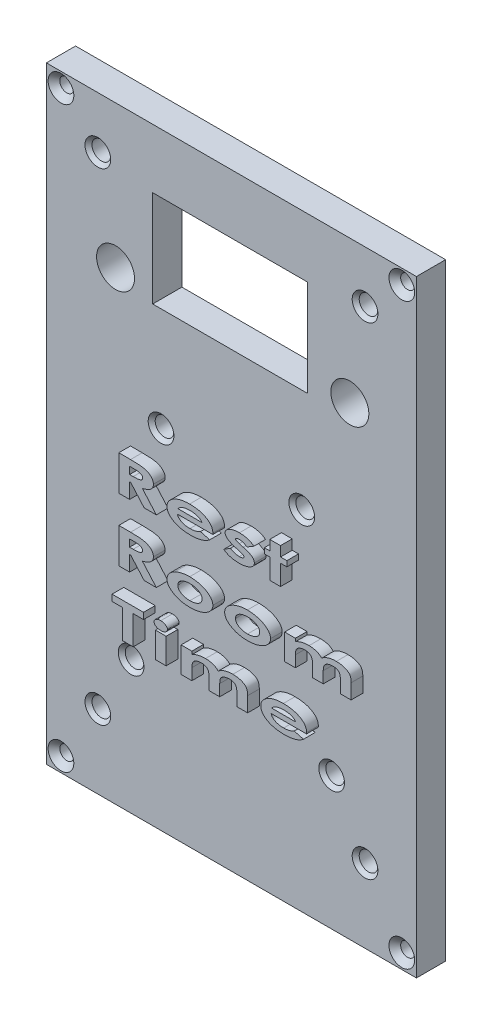
from build123d import *

# Parameters (mm, degrees)
SCHIZZO1_W                             = 63.340006879
SCHIZZO1_H                             = 103.980003745
SCHIZZO1_R                             = 1.6
SCHIZZO1_R_2                           = 3.25
SCHIZZO1_W_2                           = 26.5
SCHIZZO1_H_2                           = 16.5
ESTRUSIONE_ESTRUSIONE1_DEPTH           = 5
FORO_SVASATO_PER_VITE_M2_1_D           = 2.4
FORO_SVASATO_PER_VITE_M2_1_CSINK_D     = 4.4
FORO_SVASATO_PER_VITE_M2_1_CSINK_ANGLE = 90
FORO_SVASATO_PER_VITE_M2_2_D           = 2.4
FORO_SVASATO_PER_VITE_M2_2_CSINK_D     = 4.4
FORO_SVASATO_PER_VITE_M2_2_CSINK_ANGLE = 90
SCHIZZO10_W                            = 1.846153846
SCHIZZO10_H                            = 4.384615385
ESTRUSIONE_ESTRUSIONE3_DEPTH           = 2


with BuildPart() as part:
    # Schizzo1 → Estrusione-Estrusione1 (new body)
    with BuildSketch(Plane.XY):
        with Locations((45.670002815, -4.009999784)):
            Rectangle(SCHIZZO1_W, SCHIZZO1_H)
        with Locations((68.547653378, 39.133270494)):
            Circle(SCHIZZO1_R, mode=Mode.SUBTRACT)
        with Locations((22.813532798, 39.133270494)):
            Circle(SCHIZZO1_R, mode=Mode.SUBTRACT)
        with Locations((68.547653378, -43.377075301)):
            Circle(SCHIZZO1_R, mode=Mode.SUBTRACT)
        with Locations((22.813532798, -43.377075301)):
            Circle(SCHIZZO1_R, mode=Mode.SUBTRACT)
        with Locations((57.711115818, 3.59770492)):
            Circle(SCHIZZO1_R, mode=Mode.SUBTRACT)
        with Locations((33.630602395, 3.59770492)):
            Circle(SCHIZZO1_R, mode=Mode.SUBTRACT)
        with Locations((62.830042897, -33.235000951)):
            Circle(SCHIZZO1_R, mode=Mode.SUBTRACT)
        with Locations((28.504233864, -33.235000951)):
            Circle(SCHIZZO1_R, mode=Mode.SUBTRACT)
        with Locations((65.944072664, 23.559058576)):
            Circle(SCHIZZO1_R_2, mode=Mode.SUBTRACT)
        with Locations((25.84132705, 23.559058576)):
            Circle(SCHIZZO1_R_2, mode=Mode.SUBTRACT)
        with Locations((45.449738172, 29.587574645)):
            Rectangle(SCHIZZO1_W_2, SCHIZZO1_H_2, mode=Mode.SUBTRACT)
    extrude(amount=ESTRUSIONE_ESTRUSIONE1_DEPTH)

    # Foro svasato per Vite M2-1 (through all)
    with Locations(Plane.XY.offset(5)):
        with Locations((16.499999375, 45.480002088), (74.840006254, 45.480002088), (74.840006254, -53.500001657), (16.499999375, -53.500001657)):
            CounterSinkHole(FORO_SVASATO_PER_VITE_M2_1_D / 2, FORO_SVASATO_PER_VITE_M2_1_CSINK_D / 2, counter_sink_angle=FORO_SVASATO_PER_VITE_M2_1_CSINK_ANGLE)

    # Foro svasato per Vite M2-2 (through all)
    with Locations(Plane.XY.offset(5)):
        with Locations((33.630602395, 3.59770492), (57.711115818, 3.59770492), (62.830042897, -33.235000951), (28.504233864, -33.235000951), (22.813532798, -43.377075301), (68.547653378, -43.377075301), (68.547653378, 39.133270494), (22.813532798, 39.133270494)):
            CounterSinkHole(FORO_SVASATO_PER_VITE_M2_2_D / 2, FORO_SVASATO_PER_VITE_M2_2_CSINK_D / 2, counter_sink_angle=FORO_SVASATO_PER_VITE_M2_2_CSINK_ANGLE)

    # Schizzo10 → Estrusione-Estrusione3 (add)
    # profile 1 of 13: a face of its own
    with BuildSketch(Plane.XY.offset(5)):
        with BuildLine():
            Line((28.397988008, -1.610718218), (30.411209162, -1.610718218))
            add(Edge.make_bspline(
                [(30.411209162, -1.610718218), (30.543827285, -1.611018816), (30.799477441, -1.611598284), (31.168101714, -1.620484518), (31.507147991, -1.632952184), (31.816565795, -1.651895509), (32.096313443, -1.67693031), (32.346477034, -1.706641794), (32.566908104, -1.740391776), (32.760626099, -1.781872922), (32.935309055, -1.830084867), (33.098446352, -1.88355872), (33.252934455, -1.945102952), (33.398677263, -2.013656524), (33.535949325, -2.088993376), (33.663988148, -2.172846524), (33.784329673, -2.262356707), (33.894847104, -2.359669407), (33.994238574, -2.462468666), (34.082181891, -2.569961941), (34.155204744, -2.683182215), (34.216173076, -2.800500536), (34.263190231, -2.922666413), (34.297156332, -3.04908837), (34.316484329, -3.180638395), (34.319519948, -3.269711346), (34.321064931, -3.315045141)],
                knots=[0, 0, 0, 0, 2.021949474, 3.897745529, 5.621651746, 7.194574942, 8.62362388, 9.903335814, 11.035139957, 12.022375911, 12.921902677, 13.796954225, 14.638620021, 15.455652926, 16.251283217, 17.023881342, 17.787443489, 18.536201734, 19.26628854, 19.96557141, 20.650077513, 21.316687821, 21.978043727, 22.641849368, 23.308767469, 24, 24, 24, 24], degree=3))
            add(Edge.make_bspline(
                [(34.321064931, -3.315045141), (34.319875836, -3.362431875), (34.317533537, -3.455775055), (34.293112678, -3.592157245), (34.25794744, -3.723294101), (34.205211567, -3.848210848), (34.138020506, -3.967327776), (34.054795514, -4.079829009), (33.958841058, -4.187199883), (33.846502236, -4.287321256), (33.720593578, -4.382336927), (33.578325252, -4.469867304), (33.422516459, -4.552980365), (33.250432266, -4.628164352), (33.064411329, -4.699055695), (32.862960933, -4.763775782), (32.646777192, -4.822691817), (32.496700846, -4.855755935), (32.419622623, -4.872737448)],
                knots=[0, 0, 0, 0, 0.849371648, 1.673106448, 2.478891144, 3.281269516, 4.098927798, 4.927136135, 5.787419893, 6.67816137, 7.622767847, 8.614141728, 9.672162762, 10.788924967, 11.981178918, 13.242906675, 14.583975024, 16, 16, 16, 16], degree=3))
            Line((32.419622623, -4.872737448), (34.821064931, -7.610718218))
            Line((34.821064931, -7.610718218), (32.736930315, -7.610718218))
            Line((32.736930315, -7.610718218), (30.442459162, -4.995333602))
            Line((30.442459162, -4.995333602), (30.244141854, -4.995333602))
            Line((30.244141854, -4.995333602), (30.244141854, -7.610718218))
            Line((30.244141854, -7.610718218), (28.397988008, -7.610718218))
            Line((28.397988008, -7.610718218), (28.397988008, -1.610718218))
        make_face()
        with BuildLine():
            Line((30.244141854, -3.918410525), (30.852314931, -3.918410525))
            add(Edge.make_bspline(
                [(30.852314931, -3.918410525), (30.926434559, -3.917827523), (31.068689588, -3.916708589), (31.273153817, -3.911632929), (31.45948545, -3.899192175), (31.627810702, -3.883676398), (31.778525927, -3.865733817), (31.910730655, -3.840008365), (32.025598444, -3.812238013), (32.12339296, -3.778335389), (32.20695552, -3.739518038), (32.278707845, -3.695018251), (32.339543219, -3.644170925), (32.389949575, -3.587510843), (32.42728641, -3.523372082), (32.455621664, -3.45483601), (32.471164767, -3.379421192), (32.473631741, -3.327531466), (32.474911085, -3.300622064)],
                knots=[0, 0, 0, 0, 1.85499647, 3.560225297, 5.117551687, 6.527289447, 7.790817547, 8.913642526, 9.89607841, 10.745902707, 11.499420177, 12.197679674, 12.852398125, 13.47774471, 14.084736716, 14.701015133, 15.326361718, 16, 16, 16, 16], degree=3))
            add(Edge.make_bspline(
                [(32.474911085, -3.300622064), (32.472876278, -3.268687075), (32.468825582, -3.205113984), (32.434389874, -3.113912461), (32.378307859, -3.030420942), (32.301573098, -2.955165927), (32.207355456, -2.888569816), (32.098401787, -2.830582907), (31.974352901, -2.783923373), (31.859299127, -2.754030838), (31.75401044, -2.735716489), (31.659058366, -2.722341203), (31.548725051, -2.71212858), (31.423341693, -2.702316246), (31.282659626, -2.695415595), (31.127185969, -2.690617662), (30.956486455, -2.688606335), (30.83749135, -2.687972218), (30.775391854, -2.687641294)],
                knots=[0, 0, 0, 0, 0.77439478, 1.54159031, 2.335760054, 3.203502254, 4.138693927, 5.132119517, 6.19568532, 7.353207707, 8.016135643, 8.792976401, 9.683591908, 10.709199821, 11.850214805, 13.107209844, 14.490351265, 16, 16, 16, 16], degree=3))
            Line((30.775391854, -2.687641294), (30.244141854, -2.687641294))
            Line((30.244141854, -2.687641294), (30.244141854, -3.918410525))
        make_face(mode=Mode.SUBTRACT)
    # profile 2 of 13: a face of its own
    with BuildSketch(Plane.XY.offset(5)):
        with BuildLine():
            Line((44.490776469, -5.687641294), (38.421064931, -5.687641294))
            add(Edge.make_bspline(
                [(38.421064931, -5.687641294), (38.433337961, -5.728050418), (38.457812983, -5.808634769), (38.511663585, -5.9237011), (38.579161171, -6.032151102), (38.660738821, -6.133706634), (38.755155778, -6.229436922), (38.864055956, -6.31803137), (38.985656236, -6.401252222), (39.120742948, -6.476476597), (39.266754235, -6.544841081), (39.423860267, -6.603957917), (39.590876129, -6.652415843), (39.767377616, -6.693553902), (39.953536373, -6.725926045), (40.149767294, -6.748495305), (40.355579631, -6.761626727), (40.495965748, -6.763570931), (40.567699546, -6.764564371)],
                knots=[0, 0, 0, 0, 0.786567428, 1.568582017, 2.360345798, 3.162922845, 3.992168549, 4.86248197, 5.776141927, 6.735990573, 7.741820601, 8.77953937, 9.862019899, 10.981742977, 12.156944808, 13.382711859, 14.662631146, 16, 16, 16, 16], degree=3))
            add(Edge.make_bspline(
                [(40.567699546, -6.764564371), (40.653889402, -6.763255406), (40.823742005, -6.760675855), (41.07328771, -6.738064064), (41.314063399, -6.704329706), (41.544994103, -6.652859586), (41.767554225, -6.590253297), (41.980158136, -6.511113936), (42.184169473, -6.419609104), (42.312655421, -6.345776689), (42.376593777, -6.309035525)],
                knots=[0, 0, 0, 0, 1.095102012, 2.158095343, 3.182009107, 4.182695928, 5.162518364, 6.117784912, 7.06335487, 8, 8, 8, 8], degree=3))
            Line((42.376593777, -6.309035525), (43.959526469, -6.738122064))
            add(Edge.make_bspline(
                [(43.959526469, -6.738122064), (43.909915751, -6.777614387), (43.810033839, -6.857124802), (43.651001708, -6.96533658), (43.486377798, -7.068236525), (43.313889115, -7.162333296), (43.133270377, -7.247139134), (42.946154994, -7.325428224), (42.75146362, -7.395170513), (42.549518559, -7.457987533), (42.338739929, -7.51168888), (42.118924017, -7.558401464), (41.89018785, -7.599617942), (41.651112193, -7.631644535), (41.402576873, -7.656807739), (41.144429759, -7.67454971), (40.876692562, -7.685685018), (40.695114612, -7.68698078), (40.602555315, -7.687641294)],
                knots=[0, 0, 0, 0, 0.854656117, 1.720690401, 2.591579468, 3.471451391, 4.367880879, 5.280759393, 6.205135892, 7.155089069, 8.131129648, 9.136547434, 10.184481071, 11.263905519, 12.387785859, 13.551963195, 14.752114086, 16, 16, 16, 16], degree=3))
            add(Edge.make_bspline(
                [(40.602555315, -7.687641294), (40.459872452, -7.685977815), (40.181385261, -7.682731051), (39.773698389, -7.652116735), (39.386489909, -7.601977229), (39.018967424, -7.532915341), (38.67178752, -7.443138461), (38.345033003, -7.332042481), (38.037671234, -7.203162382), (37.798087495, -7.076834549), (37.619746788, -6.967445952), (37.494763512, -6.884038964), (37.378475474, -6.798214568), (37.271258217, -6.708341953), (37.170853895, -6.617822762), (37.081164967, -6.522793564), (37.000087019, -6.425769473), (36.926120186, -6.327264793), (36.861470195, -6.225565864), (36.805814252, -6.120848515), (36.757291246, -6.014455098), (36.719027712, -5.904447939), (36.688899583, -5.792380341), (36.666857576, -5.677957737), (36.655211442, -5.560878848), (36.652965887, -5.482134779), (36.651834162, -5.442448987)],
                knots=[0, 0, 0, 0, 2.054637344, 4.010223575, 5.883900568, 7.67528703, 9.392469401, 11.043787565, 12.641659938, 14.187696022, 14.938793558, 15.654133515, 16.351157691, 17.019008305, 17.668357262, 18.296889738, 18.898991017, 19.488689177, 20.069742437, 20.632487212, 21.195498151, 21.752086024, 22.307745975, 22.865648247, 23.428304273, 24, 24, 24, 24], degree=3))
            add(Edge.make_bspline(
                [(36.651834162, -5.442448987), (36.652960605, -5.401562985), (36.65518508, -5.320822214), (36.666794615, -5.200925493), (36.689205976, -5.083817212), (36.718372429, -4.968502092), (36.75891043, -4.856929252), (36.805748491, -4.747259294), (36.862472252, -4.641282061), (36.926183084, -4.536653781), (37.000514811, -4.435966221), (37.081164767, -4.336177559), (37.172846273, -4.240653821), (37.272338824, -4.147664342), (37.379278723, -4.055387821), (37.496490721, -3.968222041), (37.621580525, -3.882791379), (37.800433247, -3.771569976), (38.03921239, -3.644802198), (38.341516439, -3.510272092), (38.662286892, -3.399137502), (39.000192173, -3.308118315), (39.355297609, -3.235356833), (39.728492018, -3.186624141), (40.118389459, -3.153699082), (40.384134599, -3.150705838), (40.519622623, -3.149179756)],
                knots=[0, 0, 0, 0, 0.59475654, 1.174512067, 1.749327909, 2.327324109, 2.902287578, 3.473786577, 4.060208354, 4.648796988, 5.253656213, 5.878828358, 6.513512342, 7.177141678, 7.859037603, 8.56637178, 9.300067322, 10.06157577, 11.628213237, 13.227278867, 14.869113045, 16.559552067, 18.31355121, 20.136258155, 22.030102268, 24, 24, 24, 24], degree=3))
            add(Edge.make_bspline(
                [(40.519622623, -3.149179756), (40.66350591, -3.150846936), (40.944391067, -3.15410156), (41.355691391, -3.184680683), (41.74605781, -3.234910687), (42.116685343, -3.303336556), (42.465444903, -3.395831018), (42.79515168, -3.50345878), (43.102752098, -3.635813526), (43.34393128, -3.761390005), (43.524749576, -3.870335356), (43.64972648, -3.95622644), (43.766980339, -4.043786366), (43.875317099, -4.135309575), (43.975068346, -4.229842475), (44.065667865, -4.328230571), (44.149153259, -4.42849685), (44.2220057, -4.53365832), (44.287969059, -4.640563155), (44.342717958, -4.752193485), (44.391475901, -4.86569908), (44.429646003, -4.983822306), (44.461103741, -5.104055124), (44.483088621, -5.228222337), (44.494593101, -5.355289646), (44.496850748, -5.441226662), (44.497988008, -5.484516294)],
                knots=[0, 0, 0, 0, 2.029511591, 3.961959, 5.814079258, 7.579885766, 9.274267069, 10.900679463, 12.468041757, 13.992423862, 14.732964908, 15.444669546, 16.130802943, 16.796568661, 17.444190739, 18.068097756, 18.682486005, 19.283018142, 19.871379064, 20.452721621, 21.035299181, 21.612588984, 22.202034743, 22.78742928, 23.389183579, 24, 24, 24, 24], degree=3))
            Line((44.497988008, -5.484516294), (44.490776469, -5.687641294))
        make_face()
        with BuildLine():
            add(Edge.make_bspline(
                [(42.651834162, -4.841487448), (42.634878274, -4.813379884), (42.600253577, -4.755982953), (42.534091172, -4.676652105), (42.456803461, -4.601052795), (42.368853667, -4.528903893), (42.269444579, -4.460742035), (42.156906037, -4.399552512), (42.03476062, -4.338865359), (41.853718042, -4.264676988), (41.608964298, -4.186174258), (41.294591344, -4.11916458), (40.957750287, -4.079343896), (40.725662822, -4.074665555), (40.606161085, -4.072256679)],
                knots=[0, 0, 0, 0, 0.519484763, 1.060811651, 1.630890397, 2.230728536, 2.861063099, 3.537438778, 4.258537692, 5.021268243, 6.63529307, 8.323605869, 10.107026209, 12, 12, 12, 12], degree=3))
            add(Edge.make_bspline(
                [(40.606161085, -4.072256679), (40.540443256, -4.072957264), (40.410919878, -4.074338048), (40.219582943, -4.085020436), (40.034744771, -4.104342021), (39.855902569, -4.130885493), (39.683359497, -4.164196815), (39.516402258, -4.205207353), (39.355756606, -4.253851338), (39.25218941, -4.293223876), (39.201113008, -4.312641294)],
                knots=[0, 0, 0, 0, 1.09988735, 2.167769823, 3.205976562, 4.209296305, 5.192974042, 6.146005846, 7.085662686, 8, 8, 8, 8], degree=3))
            add(Edge.make_bspline(
                [(39.201113008, -4.312641294), (39.138053835, -4.340503604), (39.009519348, -4.397295781), (38.830106387, -4.51894864), (38.655370793, -4.665160615), (38.551471141, -4.78156659), (38.497988008, -4.841487448)],
                knots=[0, 0, 0, 0, 0.929626688, 1.894872474, 2.916369654, 4, 4, 4, 4], degree=3))
            Line((38.497988008, -4.841487448), (42.651834162, -4.841487448))
        make_face(mode=Mode.SUBTRACT)
    # profile 3 of 13: a face of its own
    with BuildSketch(Plane.XY.offset(5)):
        with BuildLine():
            Line((51.521064931, -3.902785525), (50.346786085, -4.610718218))
            add(Edge.make_bspline(
                [(50.346786085, -4.610718218), (50.28829149, -4.57398433), (50.174219127, -4.502348285), (50.000961244, -4.408993377), (49.832350164, -4.328775035), (49.667683416, -4.263807101), (49.507170141, -4.212552876), (49.350433693, -4.176387815), (49.197618085, -4.153587766), (49.096859817, -4.150628996), (49.047507238, -4.149179756)],
                knots=[0, 0, 0, 0, 1.186181648, 2.313214488, 3.378373229, 4.391787223, 5.351630832, 6.269788329, 7.152522082, 8, 8, 8, 8], degree=3))
            add(Edge.make_bspline(
                [(49.047507238, -4.149179756), (48.997385825, -4.149989061), (48.902520166, -4.151520846), (48.768591807, -4.165785792), (48.651072151, -4.188991534), (48.55178257, -4.222029664), (48.471247727, -4.261210606), (48.414288848, -4.30800115), (48.373176394, -4.358673112), (48.369158475, -4.398150448), (48.367218777, -4.417208602)],
                knots=[0, 0, 0, 0, 1.529023226, 2.894008499, 4.10486922, 5.175807454, 6.083495108, 6.812964079, 7.426944279, 8, 8, 8, 8], degree=3))
            add(Edge.make_bspline(
                [(48.367218777, -4.417208602), (48.368768368, -4.431462316), (48.371976758, -4.46097427), (48.394652913, -4.503368537), (48.43062618, -4.543248124), (48.472023402, -4.573780308), (48.515054826, -4.598248221), (48.559145416, -4.618404743), (48.613046655, -4.641388218), (48.677790111, -4.664947602), (48.752885403, -4.690094464), (48.837684849, -4.717804789), (48.933225918, -4.746469004), (49.00022265, -4.766198502), (49.035488008, -4.776583602)],
                knots=[0, 0, 0, 0, 0.643923198, 1.333226646, 2.129853941, 3.061911932, 3.646692856, 4.368616326, 5.254367522, 6.298567762, 7.485571102, 8.838902399, 10.336079496, 12, 12, 12, 12], degree=3))
            Line((49.035488008, -4.776583602), (49.716978392, -4.973698987))
            add(Edge.make_bspline(
                [(49.716978392, -4.973698987), (49.803286319, -4.998788573), (49.969774229, -5.047186361), (50.207026809, -5.125824516), (50.424348065, -5.202188143), (50.620084071, -5.279374381), (50.794037181, -5.359540979), (50.947870514, -5.437847994), (51.080836965, -5.516750489), (51.193676335, -5.597376126), (51.28994975, -5.679744915), (51.371904611, -5.765229882), (51.441862909, -5.853825204), (51.497980885, -5.946568138), (51.543693551, -6.042036669), (51.574531151, -6.141685377), (51.594977121, -6.24449519), (51.59697808, -6.314545165), (51.597988008, -6.34990091)],
                knots=[0, 0, 0, 0, 1.728528565, 3.334330009, 4.806386794, 6.15856827, 7.379157599, 8.488859437, 9.477330748, 10.349791586, 11.152978816, 11.910514087, 12.624179994, 13.319301575, 13.991494996, 14.654348856, 15.320820623, 16, 16, 16, 16], degree=3))
            add(Edge.make_bspline(
                [(51.597988008, -6.34990091), (51.596214229, -6.397023395), (51.592706273, -6.4902163), (51.555111012, -6.625973418), (51.498351291, -6.755684123), (51.418961906, -6.880183342), (51.315096617, -6.996518319), (51.190075814, -7.107775501), (51.042167848, -7.212218938), (50.873201531, -7.309352637), (50.686376944, -7.400225408), (50.48121641, -7.475517258), (50.262441709, -7.542494031), (50.027542364, -7.594447327), (49.778058992, -7.636549898), (49.512827812, -7.666105035), (49.232463533, -7.684428654), (49.040325153, -7.686551865), (48.941738008, -7.687641294)],
                knots=[0, 0, 0, 0, 0.693944742, 1.372396328, 2.063513165, 2.778775308, 3.541479736, 4.35818889, 5.244314131, 6.208897013, 7.23251067, 8.306719126, 9.431080877, 10.607472489, 11.854810742, 13.164193809, 14.544933928, 16, 16, 16, 16], degree=3))
            add(Edge.make_bspline(
                [(48.941738008, -7.687641294), (48.810659549, -7.685221932), (48.554869556, -7.680500725), (48.181272305, -7.647021071), (47.828125923, -7.589665054), (47.495000968, -7.509025082), (47.181321316, -7.40691404), (46.889540971, -7.277613007), (46.615056567, -7.130880019), (46.4493121, -7.01049113), (46.367218777, -6.950862448)],
                knots=[0, 0, 0, 0, 1.153900884, 2.251752898, 3.298969022, 4.300721306, 5.266631663, 6.198480534, 7.107706438, 8, 8, 8, 8], degree=3))
            Line((46.367218777, -6.950862448), (47.495824546, -6.226102833))
            add(Edge.make_bspline(
                [(47.495824546, -6.226102833), (47.551346839, -6.25999649), (47.664572715, -6.329115378), (47.848820102, -6.415078494), (48.044461124, -6.495308777), (48.250465532, -6.561875307), (48.457116144, -6.616604887), (48.656205423, -6.656235079), (48.843311524, -6.682046234), (48.964099768, -6.685822693), (49.022266854, -6.687641294)],
                knots=[0, 0, 0, 0, 0.967577213, 1.973167415, 3.021899476, 4.113827681, 5.192912693, 6.202244837, 7.134268582, 8, 8, 8, 8], degree=3))
            add(Edge.make_bspline(
                [(49.022266854, -6.687641294), (49.080018049, -6.686703365), (49.189869714, -6.68491928), (49.345765165, -6.665866809), (49.483843168, -6.634023658), (49.602424055, -6.590044487), (49.699885287, -6.538939273), (49.771527868, -6.481985185), (49.819147529, -6.418770821), (49.825650373, -6.372166887), (49.828757238, -6.34990091)],
                knots=[0, 0, 0, 0, 1.477501269, 2.810434914, 4.011758226, 5.095511231, 6.040739143, 6.81274154, 7.432763144, 8, 8, 8, 8], degree=3))
            add(Edge.make_bspline(
                [(49.828757238, -6.34990091), (49.825731663, -6.328999281), (49.819245013, -6.284187461), (49.776916632, -6.220627188), (49.711147188, -6.16041088), (49.621875868, -6.098619496), (49.506407087, -6.039933004), (49.366808211, -5.980540167), (49.202587783, -5.919909631), (49.083398847, -5.884435855), (49.019863008, -5.86552591)],
                knots=[0, 0, 0, 0, 0.509964415, 1.093332639, 1.812275614, 2.682702717, 3.732042839, 4.966732541, 6.383061365, 8, 8, 8, 8], degree=3))
            Line((49.019863008, -5.86552591), (48.393661085, -5.685237448))
            add(Edge.make_bspline(
                [(48.393661085, -5.685237448), (48.321000365, -5.663666043), (48.179834223, -5.621756849), (47.976277645, -5.552952868), (47.786770622, -5.482184905), (47.610806735, -5.410489433), (47.44946867, -5.336106095), (47.302233911, -5.259082211), (47.169012511, -5.180062919), (47.049003026, -5.099487495), (46.943398751, -5.016726881), (46.850368559, -4.932738301), (46.773839144, -4.844327245), (46.708777644, -4.756018048), (46.660303139, -4.663663499), (46.623358057, -4.570555782), (46.602484023, -4.473808231), (46.599489227, -4.408886782), (46.597988008, -4.376343218)],
                knots=[0, 0, 0, 0, 1.542700296, 2.997177164, 4.372573785, 5.659827474, 6.863901618, 7.987401647, 9.04053641, 10.015393823, 10.927335012, 11.769950169, 12.561659317, 13.303945267, 13.997121893, 14.67863953, 15.337633703, 16, 16, 16, 16], degree=3))
            add(Edge.make_bspline(
                [(46.597988008, -4.376343218), (46.599957756, -4.334435156), (46.603863799, -4.251330787), (46.63890873, -4.130131379), (46.691716053, -4.012895831), (46.769462379, -3.902166284), (46.867136528, -3.795133312), (46.986586604, -3.69357134), (47.127880384, -3.597501782), (47.287533208, -3.50573834), (47.464510938, -3.422488895), (47.65498802, -3.349318824), (47.857588351, -3.286318683), (48.072354139, -3.237072105), (48.298477047, -3.196568508), (48.536580339, -3.169968895), (48.786833993, -3.152654603), (48.957733207, -3.150355265), (49.045103392, -3.149179756)],
                knots=[0, 0, 0, 0, 0.674143721, 1.336837973, 2.018823878, 2.738914219, 3.506956523, 4.349622255, 5.259629606, 6.257701075, 7.315002513, 8.408773617, 9.544503196, 10.731882537, 11.958191311, 13.245476276, 14.59178258, 16, 16, 16, 16], degree=3))
            add(Edge.make_bspline(
                [(49.045103392, -3.149179756), (49.165785778, -3.151435612), (49.403694861, -3.155882728), (49.755285844, -3.192778396), (50.095567811, -3.253827692), (50.423123062, -3.338801796), (50.733065519, -3.445633951), (51.020808874, -3.574745192), (51.285510203, -3.723479823), (51.443383295, -3.843653789), (51.521064931, -3.902785525)],
                knots=[0, 0, 0, 0, 1.098539421, 2.165622633, 3.21452751, 4.243453856, 5.243600444, 6.195433631, 7.112061057, 8, 8, 8, 8], degree=3))
        make_face()
    # profile 4 of 13: a face of its own
    with BuildSketch(Plane.XY.offset(5)):
        Polygon((54.236449546, -1.533795141), (56.082603392, -1.533795141), (56.082603392, -3.226102833), (57.159526469, -3.226102833), (57.159526469, -4.149179756), (56.082603392, -4.149179756), (56.082603392, -7.610718218), (54.236449546, -7.610718218), (54.236449546, -4.149179756), (53.313372623, -4.149179756), (53.313372623, -3.226102833), (54.236449546, -3.226102833), align=None)
    # profile 5 of 13: a face of its own
    with BuildSketch(Plane.XY.offset(5)):
        with BuildLine():
            Line((28.397988008, -12.379948987), (30.411209162, -12.379948987))
            add(Edge.make_bspline(
                [(30.411209162, -12.379948987), (30.543827285, -12.380249585), (30.799477441, -12.380829053), (31.168101714, -12.389715288), (31.507147991, -12.402182953), (31.816565795, -12.421126279), (32.096313443, -12.446161079), (32.346477034, -12.475872563), (32.566908104, -12.509622545), (32.760626099, -12.551103692), (32.935309055, -12.599315637), (33.098446352, -12.652789489), (33.252934455, -12.714333721), (33.398677263, -12.782887293), (33.535949325, -12.858224145), (33.663988148, -12.942077293), (33.784329673, -13.031587476), (33.894847104, -13.128900176), (33.994238574, -13.231699435), (34.082181891, -13.33919271), (34.155204744, -13.452412984), (34.216173076, -13.569731306), (34.263190231, -13.691897182), (34.297156332, -13.818319139), (34.316484329, -13.949869164), (34.319519948, -14.038942115), (34.321064931, -14.08427591)],
                knots=[0, 0, 0, 0, 2.021949474, 3.897745529, 5.621651746, 7.194574942, 8.62362388, 9.903335814, 11.035139957, 12.022375911, 12.921902677, 13.796954225, 14.638620021, 15.455652926, 16.251283217, 17.023881342, 17.787443489, 18.536201734, 19.26628854, 19.96557141, 20.650077513, 21.316687821, 21.978043727, 22.641849368, 23.308767469, 24, 24, 24, 24], degree=3))
            add(Edge.make_bspline(
                [(34.321064931, -14.08427591), (34.319875836, -14.131662644), (34.317533537, -14.225005824), (34.293112678, -14.361388014), (34.25794744, -14.49252487), (34.205211567, -14.617441617), (34.138020506, -14.736558545), (34.054795514, -14.849059779), (33.958841058, -14.956430652), (33.846502236, -15.056552026), (33.720593578, -15.151567696), (33.578325252, -15.239098073), (33.422516459, -15.322211134), (33.250432266, -15.397395121), (33.064411329, -15.468286464), (32.862960933, -15.533006551), (32.646777192, -15.591922587), (32.496700846, -15.624986704), (32.419622623, -15.641968218)],
                knots=[0, 0, 0, 0, 0.849371648, 1.673106448, 2.478891144, 3.281269516, 4.098927798, 4.927136135, 5.787419893, 6.67816137, 7.622767847, 8.614141728, 9.672162762, 10.788924967, 11.981178918, 13.242906675, 14.583975024, 16, 16, 16, 16], degree=3))
            Line((32.419622623, -15.641968218), (34.821064931, -18.379948987))
            Line((34.821064931, -18.379948987), (32.736930315, -18.379948987))
            Line((32.736930315, -18.379948987), (30.442459162, -15.764564371))
            Line((30.442459162, -15.764564371), (30.244141854, -15.764564371))
            Line((30.244141854, -15.764564371), (30.244141854, -18.379948987))
            Line((30.244141854, -18.379948987), (28.397988008, -18.379948987))
            Line((28.397988008, -18.379948987), (28.397988008, -12.379948987))
        make_face()
        with BuildLine():
            Line((30.244141854, -14.687641294), (30.852314931, -14.687641294))
            add(Edge.make_bspline(
                [(30.852314931, -14.687641294), (30.926434559, -14.687058292), (31.068689588, -14.685939358), (31.273153817, -14.680863698), (31.45948545, -14.668422944), (31.627810702, -14.652907167), (31.778525927, -14.634964586), (31.910730655, -14.609239134), (32.025598444, -14.581468782), (32.12339296, -14.547566158), (32.20695552, -14.508748807), (32.278707845, -14.46424902), (32.339543219, -14.413401694), (32.389949575, -14.356741612), (32.42728641, -14.292602852), (32.455621664, -14.22406678), (32.471164767, -14.148651961), (32.473631741, -14.096762235), (32.474911085, -14.069852833)],
                knots=[0, 0, 0, 0, 1.85499647, 3.560225297, 5.117551687, 6.527289447, 7.790817547, 8.913642526, 9.89607841, 10.745902707, 11.499420177, 12.197679674, 12.852398125, 13.47774471, 14.084736716, 14.701015133, 15.326361718, 16, 16, 16, 16], degree=3))
            add(Edge.make_bspline(
                [(32.474911085, -14.069852833), (32.472876278, -14.037917844), (32.468825582, -13.974344753), (32.434389874, -13.88314323), (32.378307859, -13.799651711), (32.301573098, -13.724396696), (32.207355456, -13.657800585), (32.098401787, -13.599813676), (31.974352901, -13.553154142), (31.859299127, -13.523261607), (31.75401044, -13.504947259), (31.659058366, -13.491571973), (31.548725051, -13.481359349), (31.423341693, -13.471547015), (31.282659626, -13.464646365), (31.127185969, -13.459848431), (30.956486455, -13.457837104), (30.83749135, -13.457202988), (30.775391854, -13.456872064)],
                knots=[0, 0, 0, 0, 0.77439478, 1.54159031, 2.335760054, 3.203502254, 4.138693927, 5.132119517, 6.19568532, 7.353207707, 8.016135643, 8.792976401, 9.683591908, 10.709199821, 11.850214805, 13.107209844, 14.490351265, 16, 16, 16, 16], degree=3))
            Line((30.775391854, -13.456872064), (30.244141854, -13.456872064))
            Line((30.244141854, -13.456872064), (30.244141854, -14.687641294))
        make_face(mode=Mode.SUBTRACT)
    # profile 6 of 13: a face of its own
    with BuildSketch(Plane.XY.offset(5)):
        with BuildLine():
            add(Edge.make_bspline(
                [(40.530439931, -13.918410525), (40.618199091, -13.919326638), (40.792234206, -13.92114338), (41.051256269, -13.935919789), (41.306134398, -13.960344762), (41.557365628, -13.991878256), (41.804269445, -14.03563328), (42.047037349, -14.088935982), (42.286522961, -14.149237961), (42.519430227, -14.2218455), (42.74470999, -14.30025779), (42.958771091, -14.386368416), (43.159667453, -14.480801609), (43.349389277, -14.579500522), (43.524105493, -14.688454569), (43.68821285, -14.801235179), (43.837979828, -14.922729691), (43.975139801, -15.049815582), (44.0975952, -15.181363299), (44.204317635, -15.316731467), (44.29456703, -15.454637515), (44.368863676, -15.595390895), (44.427034322, -15.738607766), (44.468105137, -15.884917725), (44.492861339, -16.033753138), (44.496276473, -16.13386386), (44.497988008, -16.184035525)],
                knots=[0, 0, 0, 0, 1.265940792, 2.510486111, 3.741199044, 4.959170855, 6.162116729, 7.356968714, 8.544276639, 9.723439993, 10.875014664, 11.984755685, 13.050035749, 14.076429324, 15.067691783, 16.018447118, 16.947253998, 17.846941071, 18.713956268, 19.537177321, 20.330687547, 21.088166391, 21.829780047, 22.55619397, 23.276419638, 24, 24, 24, 24], degree=3))
            add(Edge.make_bspline(
                [(44.497988008, -16.184035525), (44.496234755, -16.234594283), (44.492736471, -16.335474719), (44.468590238, -16.485804158), (44.425114133, -16.632531262), (44.369218516, -16.778335943), (44.293702834, -16.919845448), (44.202565315, -17.059217938), (44.095213907, -17.19630611), (43.97200597, -17.329910068), (43.834471535, -17.45814332), (43.685775832, -17.581649217), (43.522409947, -17.694672939), (43.34964587, -17.803812278), (43.163671612, -17.903245492), (42.965958005, -17.995499826), (42.757044428, -18.082523355), (42.536466316, -18.159767765), (42.307380391, -18.229097384), (42.071764447, -18.290715081), (41.830281725, -18.342111769), (41.582909307, -18.384402216), (41.32985757, -18.416686782), (41.070808911, -18.439003939), (40.806262979, -18.454264932), (40.627817501, -18.455996916), (40.537651469, -18.456872064)],
                knots=[0, 0, 0, 0, 0.728759206, 1.454101135, 2.18705835, 2.931303608, 3.701078261, 4.493944655, 5.329151475, 6.207866333, 7.110765712, 8.037992116, 8.991287713, 9.971932766, 10.982209905, 12.02848696, 13.115947981, 14.242882043, 15.39562174, 16.565191902, 17.752210956, 18.953195421, 20.181634505, 21.42807642, 22.700442589, 24, 24, 24, 24], degree=3))
            add(Edge.make_bspline(
                [(40.537651469, -18.456872064), (40.405787447, -18.454649069), (40.146921599, -18.450285048), (39.76595104, -18.42026326), (39.399909089, -18.368639773), (39.048219893, -18.29656729), (38.710841566, -18.204810259), (38.389269748, -18.089574807), (38.081293542, -17.956623869), (37.837581785, -17.827221663), (37.653462304, -17.714980068), (37.523709335, -17.629662931), (37.404203182, -17.540822073), (37.29286669, -17.450458116), (37.190482466, -17.357839559), (37.096939481, -17.263191842), (37.011653027, -17.166496282), (36.936665621, -17.066676564), (36.867985669, -16.965679998), (36.811174037, -16.860800452), (36.760870104, -16.754926849), (36.721558971, -16.646063091), (36.689864784, -16.535747634), (36.668423184, -16.422671769), (36.654853228, -16.307763612), (36.652842089, -16.230146588), (36.651834162, -16.191247064)],
                knots=[0, 0, 0, 0, 1.927555344, 3.784036287, 5.582177344, 7.328045527, 9.028781886, 10.688537513, 12.31733635, 13.92860432, 14.717078596, 15.469149608, 16.197730675, 16.892896808, 17.564600043, 18.214792588, 18.837361948, 19.447633942, 20.038893574, 20.620826713, 21.1894036, 21.750816835, 22.310731212, 22.865506817, 23.431423114, 24, 24, 24, 24], degree=3))
            add(Edge.make_bspline(
                [(36.651834162, -16.191247064), (36.652633865, -16.149526211), (36.654223654, -16.066586309), (36.670818354, -15.943645182), (36.695656833, -15.823386362), (36.730980608, -15.70609425), (36.775396881, -15.591274424), (36.831036786, -15.479123192), (36.897563203, -15.369790601), (36.973550129, -15.262625135), (37.058850842, -15.158007204), (37.154535449, -15.056500734), (37.260537954, -14.958226006), (37.376236347, -14.862156002), (37.501181479, -14.767761778), (37.637988883, -14.678595314), (37.782841836, -14.588514917), (37.885466383, -14.533999806), (37.937891854, -14.50615091)],
                knots=[0, 0, 0, 0, 0.895362313, 1.779955521, 2.659009477, 3.529985937, 4.407059137, 5.299648078, 6.214390826, 7.152461182, 8.118516572, 9.110538608, 10.145320296, 11.220372081, 12.338748077, 13.505510881, 14.725697036, 16, 16, 16, 16], degree=3))
            add(Edge.make_bspline(
                [(37.937891854, -14.50615091), (38.032994411, -14.458646735), (38.223845579, -14.363315678), (38.523145683, -14.245758634), (38.831623644, -14.144185241), (39.150687013, -14.061042505), (39.480808678, -13.99773948), (39.821499371, -13.952367037), (40.172588863, -13.924041347), (40.410194321, -13.920302602), (40.530439931, -13.918410525)],
                knots=[0, 0, 0, 0, 0.950148044, 1.906750665, 2.871947648, 3.85293107, 4.852697354, 5.875609384, 6.924904138, 8, 8, 8, 8], degree=3))
        make_face()
        with BuildLine():
            add(Edge.make_bspline(
                [(40.571305315, -14.918410525), (40.498774431, -14.919803981), (40.356350052, -14.922540223), (40.147388546, -14.936920625), (39.948255159, -14.96714734), (39.757537372, -15.004375219), (39.576774187, -15.055455369), (39.404037384, -15.1148164), (39.242425015, -15.188942925), (39.090433385, -15.27070974), (38.952112087, -15.361142383), (38.831898696, -15.460091581), (38.727643497, -15.563322478), (38.64430292, -15.675117795), (38.578043951, -15.792323724), (38.532170032, -15.916938474), (38.503663544, -16.047331469), (38.499890377, -16.136615923), (38.497988008, -16.181631679)],
                knots=[0, 0, 0, 0, 1.29966981, 2.552080606, 3.748873556, 4.905985143, 6.03097135, 7.111551771, 8.174877936, 9.212306099, 10.201717801, 11.129954838, 11.997870153, 12.823312326, 13.620172785, 14.401461113, 15.194042922, 16, 16, 16, 16], degree=3))
            add(Edge.make_bspline(
                [(38.497988008, -16.181631679), (38.499978654, -16.228223745), (38.503889804, -16.319766151), (38.530578139, -16.453652622), (38.576928182, -16.580446613), (38.64267023, -16.699691969), (38.72557478, -16.812680282), (38.826160309, -16.919225126), (38.946229675, -17.017604054), (39.083225253, -17.108026486), (39.233365241, -17.190585802), (39.395628051, -17.260880878), (39.56625868, -17.322929275), (39.747364296, -17.371630218), (39.937665723, -17.409991996), (40.137913454, -17.437855412), (40.347916757, -17.45287676), (40.491155234, -17.455524041), (40.564093777, -17.456872064)],
                knots=[0, 0, 0, 0, 0.83184601, 1.634380945, 2.426517084, 3.233281859, 4.05749425, 4.922902993, 5.842558818, 6.822747909, 7.850475165, 8.897933112, 9.977348038, 11.089826779, 12.243123404, 13.442047824, 14.697463782, 16, 16, 16, 16], degree=3))
            add(Edge.make_bspline(
                [(40.564093777, -17.456872064), (40.637444939, -17.455692008), (40.780739115, -17.453386727), (40.991007594, -17.436128361), (41.191685152, -17.408762947), (41.383462825, -17.370869042), (41.565578149, -17.319820647), (41.738584234, -17.259148006), (41.902236932, -17.186524843), (42.054648537, -17.103352926), (42.193544691, -17.011487336), (42.316420728, -16.913328542), (42.419184718, -16.806633675), (42.504681264, -16.694649707), (42.570181104, -16.57537132), (42.618029558, -16.450205878), (42.646142779, -16.317889506), (42.649920961, -16.227435751), (42.651834162, -16.181631679)],
                knots=[0, 0, 0, 0, 1.303383627, 2.546207562, 3.746413811, 4.901138048, 6.017018097, 7.104649258, 8.156456738, 9.195146267, 10.186416423, 11.112656285, 11.983731231, 12.812460638, 13.609099142, 14.393231776, 15.186362949, 16, 16, 16, 16], degree=3))
            add(Edge.make_bspline(
                [(42.651834162, -16.181631679), (42.649826149, -16.135839026), (42.645864284, -16.045488826), (42.619185659, -15.913223238), (42.573204963, -15.787801908), (42.506686624, -15.670611291), (42.424281021, -15.558541384), (42.322400724, -15.45398056), (42.202025529, -15.356595829), (42.0658127, -15.265665912), (41.914535576, -15.185386721), (41.753318326, -15.112190649), (41.580791688, -15.052909478), (41.398537962, -15.003328284), (41.206109268, -14.965368269), (41.003493514, -14.937412488), (40.790683953, -14.922381565), (40.645445177, -14.919752553), (40.571305315, -14.918410525)],
                knots=[0, 0, 0, 0, 0.816368961, 1.610719063, 2.394983412, 3.188047637, 4.005291257, 4.869189981, 5.782951973, 6.761698352, 7.784500958, 8.833316183, 9.915489392, 11.033223085, 12.198828477, 13.410141754, 14.677958211, 16, 16, 16, 16], degree=3))
        make_face(mode=Mode.SUBTRACT)
    # profile 7 of 13: a face of its own
    with BuildSketch(Plane.XY.offset(5)):
        with BuildLine():
            add(Edge.make_bspline(
                [(50.3996707, -13.918410525), (50.48742986, -13.919326638), (50.661464975, -13.92114338), (50.920487038, -13.935919789), (51.175365167, -13.960344762), (51.426596397, -13.991878256), (51.673500214, -14.03563328), (51.916268118, -14.088935982), (52.15575373, -14.149237961), (52.388660996, -14.2218455), (52.61394076, -14.30025779), (52.82800186, -14.386368416), (53.028898222, -14.480801609), (53.218620046, -14.579500522), (53.393336262, -14.688454569), (53.557443619, -14.801235179), (53.707210598, -14.922729691), (53.84437057, -15.049815582), (53.966825969, -15.181363299), (54.073548404, -15.316731467), (54.163797799, -15.454637515), (54.238094445, -15.595390895), (54.296265091, -15.738607766), (54.337335906, -15.884917725), (54.362092109, -16.033753138), (54.365507242, -16.13386386), (54.367218777, -16.184035525)],
                knots=[0, 0, 0, 0, 1.265940792, 2.510486111, 3.741199044, 4.959170855, 6.162116729, 7.356968714, 8.544276639, 9.723439993, 10.875014664, 11.984755685, 13.050035749, 14.076429324, 15.067691783, 16.018447118, 16.947253998, 17.846941071, 18.713956268, 19.537177321, 20.330687547, 21.088166391, 21.829780047, 22.55619397, 23.276419638, 24, 24, 24, 24], degree=3))
            add(Edge.make_bspline(
                [(54.367218777, -16.184035525), (54.365465524, -16.234594283), (54.36196724, -16.335474719), (54.337821008, -16.485804158), (54.294344902, -16.632531262), (54.238449285, -16.778335943), (54.162933603, -16.919845448), (54.071796085, -17.059217938), (53.964444677, -17.19630611), (53.84123674, -17.329910068), (53.703702304, -17.45814332), (53.555006601, -17.581649217), (53.391640716, -17.694672939), (53.218876639, -17.803812278), (53.032902381, -17.903245492), (52.835188775, -17.995499826), (52.626275197, -18.082523355), (52.405697086, -18.159767765), (52.17661116, -18.229097384), (51.940995216, -18.290715081), (51.699512494, -18.342111769), (51.452140076, -18.384402216), (51.199088339, -18.416686782), (50.94003968, -18.439003939), (50.675493748, -18.454264932), (50.49704827, -18.455996916), (50.406882238, -18.456872064)],
                knots=[0, 0, 0, 0, 0.728759206, 1.454101135, 2.18705835, 2.931303608, 3.701078261, 4.493944655, 5.329151475, 6.207866333, 7.110765712, 8.037992116, 8.991287713, 9.971932766, 10.982209905, 12.02848696, 13.115947981, 14.242882043, 15.39562174, 16.565191902, 17.752210956, 18.953195421, 20.181634505, 21.42807642, 22.700442589, 24, 24, 24, 24], degree=3))
            add(Edge.make_bspline(
                [(50.406882238, -18.456872064), (50.275018216, -18.454649069), (50.016152369, -18.450285048), (49.63518181, -18.42026326), (49.269139858, -18.368639773), (48.917450663, -18.29656729), (48.580072336, -18.204810259), (48.258500518, -18.089574807), (47.950524312, -17.956623869), (47.706812555, -17.827221663), (47.522693073, -17.714980068), (47.392940105, -17.629662931), (47.273433951, -17.540822073), (47.162097459, -17.450458116), (47.059713235, -17.357839559), (46.966170251, -17.263191842), (46.880883796, -17.166496282), (46.80589639, -17.066676564), (46.737216438, -16.965679998), (46.680404806, -16.860800452), (46.630100874, -16.754926849), (46.59078974, -16.646063091), (46.559095554, -16.535747634), (46.537653953, -16.422671769), (46.524083998, -16.307763612), (46.522072859, -16.230146588), (46.521064931, -16.191247064)],
                knots=[0, 0, 0, 0, 1.927555344, 3.784036287, 5.582177344, 7.328045527, 9.028781886, 10.688537513, 12.31733635, 13.92860432, 14.717078596, 15.469149608, 16.197730675, 16.892896808, 17.564600043, 18.214792588, 18.837361948, 19.447633942, 20.038893574, 20.620826713, 21.1894036, 21.750816835, 22.310731212, 22.865506817, 23.431423114, 24, 24, 24, 24], degree=3))
            add(Edge.make_bspline(
                [(46.521064931, -16.191247064), (46.521864635, -16.149526211), (46.523454424, -16.066586309), (46.540049123, -15.943645182), (46.564887602, -15.823386362), (46.600211377, -15.70609425), (46.64462765, -15.591274424), (46.700267555, -15.479123192), (46.766793973, -15.369790601), (46.842780899, -15.262625135), (46.928081612, -15.158007204), (47.023766218, -15.056500734), (47.129768723, -14.958226006), (47.245467116, -14.862156002), (47.370412248, -14.767761778), (47.507219652, -14.678595314), (47.652072605, -14.588514917), (47.754697153, -14.533999806), (47.807122623, -14.50615091)],
                knots=[0, 0, 0, 0, 0.895362313, 1.779955521, 2.659009477, 3.529985937, 4.407059137, 5.299648078, 6.214390826, 7.152461182, 8.118516572, 9.110538608, 10.145320296, 11.220372081, 12.338748077, 13.505510881, 14.725697036, 16, 16, 16, 16], degree=3))
            add(Edge.make_bspline(
                [(47.807122623, -14.50615091), (47.90222518, -14.458646735), (48.093076349, -14.363315678), (48.392376453, -14.245758634), (48.700854413, -14.144185241), (49.019917782, -14.061042505), (49.350039447, -13.99773948), (49.69073014, -13.952367037), (50.041819632, -13.924041347), (50.27942509, -13.920302602), (50.3996707, -13.918410525)],
                knots=[0, 0, 0, 0, 0.950148044, 1.906750665, 2.871947648, 3.85293107, 4.852697354, 5.875609384, 6.924904138, 8, 8, 8, 8], degree=3))
        make_face()
        with BuildLine():
            add(Edge.make_bspline(
                [(50.440536085, -14.918410525), (50.3680052, -14.919803981), (50.225580822, -14.922540223), (50.016619315, -14.936920625), (49.817485928, -14.96714734), (49.626768141, -15.004375219), (49.446004956, -15.055455369), (49.273268153, -15.1148164), (49.111655784, -15.188942925), (48.959664154, -15.27070974), (48.821342856, -15.361142383), (48.701129465, -15.460091581), (48.596874267, -15.563322478), (48.513533689, -15.675117795), (48.447274721, -15.792323724), (48.401400801, -15.916938474), (48.372894313, -16.047331469), (48.369121146, -16.136615923), (48.367218777, -16.181631679)],
                knots=[0, 0, 0, 0, 1.29966981, 2.552080606, 3.748873556, 4.905985143, 6.03097135, 7.111551771, 8.174877936, 9.212306099, 10.201717801, 11.129954838, 11.997870153, 12.823312326, 13.620172785, 14.401461113, 15.194042922, 16, 16, 16, 16], degree=3))
            add(Edge.make_bspline(
                [(48.367218777, -16.181631679), (48.369209423, -16.228223745), (48.373120573, -16.319766151), (48.399808909, -16.453652622), (48.446158951, -16.580446613), (48.511900999, -16.699691969), (48.594805549, -16.812680282), (48.695391078, -16.919225126), (48.815460444, -17.017604054), (48.952456022, -17.108026486), (49.102596011, -17.190585802), (49.26485882, -17.260880878), (49.435489449, -17.322929275), (49.616595065, -17.371630218), (49.806896492, -17.409991996), (50.007144223, -17.437855412), (50.217147526, -17.45287676), (50.360386003, -17.455524041), (50.433324546, -17.456872064)],
                knots=[0, 0, 0, 0, 0.83184601, 1.634380945, 2.426517084, 3.233281859, 4.05749425, 4.922902993, 5.842558818, 6.822747909, 7.850475165, 8.897933112, 9.977348038, 11.089826779, 12.243123404, 13.442047824, 14.697463782, 16, 16, 16, 16], degree=3))
            add(Edge.make_bspline(
                [(50.433324546, -17.456872064), (50.506675708, -17.455692008), (50.649969885, -17.453386727), (50.860238363, -17.436128361), (51.060915921, -17.408762947), (51.252693594, -17.370869042), (51.434808918, -17.319820647), (51.607815004, -17.259148006), (51.771467701, -17.186524843), (51.923879307, -17.103352926), (52.06277546, -17.011487336), (52.185651497, -16.913328542), (52.288415487, -16.806633675), (52.373912033, -16.694649707), (52.439411873, -16.57537132), (52.487260327, -16.450205878), (52.515373548, -16.317889506), (52.519151731, -16.227435751), (52.521064931, -16.181631679)],
                knots=[0, 0, 0, 0, 1.303383627, 2.546207562, 3.746413811, 4.901138048, 6.017018097, 7.104649258, 8.156456738, 9.195146267, 10.186416423, 11.112656285, 11.983731231, 12.812460638, 13.609099142, 14.393231776, 15.186362949, 16, 16, 16, 16], degree=3))
            add(Edge.make_bspline(
                [(52.521064931, -16.181631679), (52.519056918, -16.135839026), (52.515095053, -16.045488826), (52.488416428, -15.913223238), (52.442435732, -15.787801908), (52.375917394, -15.670611291), (52.293511791, -15.558541384), (52.191631494, -15.45398056), (52.071256299, -15.356595829), (51.935043469, -15.265665912), (51.783766345, -15.185386721), (51.622549095, -15.112190649), (51.450022458, -15.052909478), (51.267768732, -15.003328284), (51.075340038, -14.965368269), (50.872724283, -14.937412488), (50.659914723, -14.922381565), (50.514675946, -14.919752553), (50.440536085, -14.918410525)],
                knots=[0, 0, 0, 0, 0.816368961, 1.610719063, 2.394983412, 3.188047637, 4.005291257, 4.869189981, 5.782951973, 6.761698352, 7.784500958, 8.833316183, 9.915489392, 11.033223085, 12.198828477, 13.410141754, 14.677958211, 16, 16, 16, 16], degree=3))
        make_face(mode=Mode.SUBTRACT)
    # profile 8 of 13: a face of its own
    with BuildSketch(Plane.XY.offset(5)):
        with BuildLine():
            Line((56.774911085, -13.995333602), (58.621064931, -13.995333602))
            Line((58.621064931, -13.995333602), (58.621064931, -14.519372064))
            add(Edge.make_bspline(
                [(58.621064931, -14.519372064), (58.702418712, -14.470667757), (58.86593004, -14.372777951), (59.127166654, -14.251059561), (59.400711444, -14.147297216), (59.687675104, -14.06318071), (59.987875393, -13.998761551), (60.300941718, -13.951857367), (60.627369771, -13.924031), (60.849376488, -13.920306733), (60.962411085, -13.918410525)],
                knots=[0, 0, 0, 0, 0.928492069, 1.866157527, 2.819023524, 3.792835013, 4.792976067, 5.824993516, 6.892596658, 8, 8, 8, 8], degree=3))
            add(Edge.make_bspline(
                [(60.962411085, -13.918410525), (61.075893988, -13.92055079), (61.298290119, -13.924745137), (61.622872179, -13.962445255), (61.930544981, -14.024950746), (62.174078694, -14.097871072), (62.358189997, -14.169582715), (62.489643434, -14.225962479), (62.612271037, -14.292159723), (62.729509897, -14.361542529), (62.839626983, -14.43689054), (62.942994856, -14.518195495), (63.03893424, -14.605467804), (63.097831931, -14.66840988), (63.127074546, -14.699660525)],
                knots=[0, 0, 0, 0, 1.724418423, 3.379398793, 4.958225664, 6.491656286, 7.235778459, 7.961048813, 8.663857899, 9.352084907, 10.031090297, 10.69016989, 11.349671331, 12, 12, 12, 12], degree=3))
            add(Edge.make_bspline(
                [(63.127074546, -14.699660525), (63.204231702, -14.637637453), (63.360200214, -14.512261573), (63.624018147, -14.35686049), (63.910228733, -14.221717354), (64.221576649, -14.112300376), (64.551934542, -14.024919626), (64.899237443, -13.962998955), (65.261224708, -13.924699456), (65.507586495, -13.920532956), (65.633084162, -13.918410525)],
                knots=[0, 0, 0, 0, 0.885912443, 1.790818283, 2.734967203, 3.71815572, 4.742904095, 5.793374269, 6.875936137, 8, 8, 8, 8], degree=3))
            add(Edge.make_bspline(
                [(65.633084162, -13.918410525), (65.698398966, -13.919195086), (65.827095424, -13.920740986), (66.016769105, -13.930192657), (66.200436391, -13.946962482), (66.377980722, -13.971231647), (66.550152074, -14.000872315), (66.71591683, -14.037857605), (66.87528718, -14.082947775), (67.02811979, -14.132934525), (67.173165072, -14.187689338), (67.308192402, -14.247563154), (67.432183141, -14.312986648), (67.546399922, -14.380643902), (67.649642594, -14.453446239), (67.742120032, -14.53015531), (67.824798846, -14.610850033), (67.896869989, -14.697818798), (67.961193742, -14.792705049), (68.01355337, -14.901669607), (68.059190391, -15.023084074), (68.096004348, -15.158346282), (68.124816887, -15.3069972), (68.144192085, -15.4692987), (68.158361887, -15.644925087), (68.159129327, -15.7665358), (68.159526469, -15.829468218)],
                knots=[0, 0, 0, 0, 1.289291102, 2.540422463, 3.747590693, 4.92867586, 6.076732526, 7.195292088, 8.279438393, 9.344817614, 10.368553605, 11.33855308, 12.258279101, 13.134438041, 13.957256052, 14.74908619, 15.504040245, 16.234103687, 16.975473436, 17.760640756, 18.614054403, 19.533100153, 20.52418037, 21.60024899, 22.758151088, 24, 24, 24, 24], degree=3))
            Line((68.159526469, -15.829468218), (68.159526469, -18.379948987))
            Line((68.159526469, -18.379948987), (66.313372623, -18.379948987))
            Line((66.313372623, -18.379948987), (66.313372623, -16.17802591))
            add(Edge.make_bspline(
                [(66.313372623, -16.17802591), (66.312642573, -16.119090841), (66.311239215, -16.005801483), (66.295313353, -15.843550025), (66.270640065, -15.695935896), (66.235926096, -15.563095451), (66.192422884, -15.444180234), (66.136365181, -15.341039798), (66.071820529, -15.251377699), (65.993740656, -15.178512291), (65.907198247, -15.116750574), (65.811019751, -15.063622324), (65.705163451, -15.018159651), (65.58938333, -14.980659291), (65.463184391, -14.95372051), (65.327487601, -14.933713589), (65.181852239, -14.919644994), (65.081436744, -14.918830184), (65.029718777, -14.918410525)],
                knots=[0, 0, 0, 0, 1.348092376, 2.591403118, 3.726261935, 4.769120742, 5.729414895, 6.615424195, 7.447833497, 8.245388874, 9.046781074, 9.875750653, 10.754473844, 11.679281639, 12.655717778, 13.703280238, 14.817098143, 16, 16, 16, 16], degree=3))
            add(Edge.make_bspline(
                [(65.029718777, -14.918410525), (64.950292808, -14.920070242), (64.795247734, -14.923310127), (64.568953362, -14.954048629), (64.355212385, -15.004492658), (64.155683664, -15.07343052), (63.974138647, -15.158625867), (63.815676746, -15.261047741), (63.682632953, -15.380307205), (63.590883301, -15.493507861), (63.530352086, -15.594797287), (63.494285236, -15.682374694), (63.461015553, -15.779247235), (63.435494107, -15.887215286), (63.414789656, -16.006000358), (63.401433386, -16.135334178), (63.390812971, -16.275208529), (63.390472238, -16.371912713), (63.3902957, -16.422016294)],
                knots=[0, 0, 0, 0, 1.485092214, 2.89900437, 4.262337849, 5.587228045, 6.840936878, 8.004976307, 9.103480475, 10.169734639, 10.717284049, 11.304766602, 11.937540181, 12.631890893, 13.377305733, 14.19167655, 15.063086222, 16, 16, 16, 16], degree=3))
            Line((63.3902957, -16.422016294), (63.3902957, -18.379948987))
            Line((63.3902957, -18.379948987), (61.544141854, -18.379948987))
            Line((61.544141854, -18.379948987), (61.544141854, -16.277785525))
            add(Edge.make_bspline(
                [(61.544141854, -16.277785525), (61.543770971, -16.230894992), (61.543057258, -16.140660479), (61.535111793, -16.010441984), (61.525622247, -15.889888232), (61.50782818, -15.779426552), (61.48892188, -15.678125871), (61.461533387, -15.587790098), (61.432616361, -15.506716024), (61.385466919, -15.413846072), (61.315815585, -15.310098029), (61.212045162, -15.203267152), (61.089922132, -15.113016157), (60.949428355, -15.04143432), (60.792286284, -14.986660658), (60.620493094, -14.94543135), (60.432123977, -14.923517569), (60.301805701, -14.920157578), (60.2340457, -14.918410525)],
                knots=[0, 0, 0, 0, 1.023877294, 1.970313919, 2.848831416, 3.663081015, 4.412965741, 5.096851674, 5.722570136, 6.289960045, 7.367466338, 8.437986872, 9.526485706, 10.669198793, 11.867539458, 13.153642433, 14.52001424, 16, 16, 16, 16], degree=3))
            add(Edge.make_bspline(
                [(60.2340457, -14.918410525), (60.157397657, -14.9199221), (60.00743328, -14.922879544), (59.788219239, -14.955950614), (59.579346313, -15.005545639), (59.383306055, -15.075896716), (59.204490855, -15.16378727), (59.046893409, -15.268574596), (58.914605785, -15.391346087), (58.82227699, -15.507365208), (58.762952385, -15.611746123), (58.724142713, -15.700699403), (58.692417711, -15.800321938), (58.666136057, -15.910012151), (58.64560621, -16.030059861), (58.632193631, -16.160572328), (58.62158724, -16.301653588), (58.621243156, -16.399156939), (58.621064931, -16.449660525)],
                knots=[0, 0, 0, 0, 1.435780243, 2.809150516, 4.146225197, 5.455245645, 6.704737693, 7.8733525, 8.989427018, 10.075661758, 10.637401591, 11.2360384, 11.891571272, 12.59472446, 13.349155542, 14.172755911, 15.053546593, 16, 16, 16, 16], degree=3))
            Line((58.621064931, -16.449660525), (58.621064931, -18.379948987))
            Line((58.621064931, -18.379948987), (56.774911085, -18.379948987))
            Line((56.774911085, -18.379948987), (56.774911085, -13.995333602))
        make_face()
    # profile 9 of 13: a face of its own
    with BuildSketch(Plane.XY.offset(5)):
        Polygon((27.244141854, -23.149179756), (32.628757238, -23.149179756), (32.628757238, -24.226102833), (30.859526469, -24.226102833), (30.859526469, -29.149179756), (29.013372623, -29.149179756), (29.013372623, -24.226102833), (27.244141854, -24.226102833), align=None)
    # profile 10 of 13: a face of its own
    with BuildSketch(Plane.XY.offset(5)):
        with BuildLine():
            add(Edge.make_bspline(
                [(35.571305315, -22.918410525), (35.648025511, -22.920674582), (35.797022476, -22.925071568), (36.011485322, -22.966931311), (36.209156998, -23.034495109), (36.359181504, -23.112985929), (36.466806593, -23.185864136), (36.53590626, -23.244433626), (36.595858593, -23.304260544), (36.644022468, -23.368345601), (36.682438394, -23.435155681), (36.708285861, -23.505569536), (36.72670306, -23.578128139), (36.728070607, -23.627830481), (36.728757238, -23.652785525)],
                knots=[0, 0, 0, 0, 1.83334635, 3.560510224, 5.203057982, 6.814706011, 7.593510634, 8.30760556, 8.978469519, 9.614769865, 10.219777363, 10.814219576, 11.404631624, 12, 12, 12, 12], degree=3))
            add(Edge.make_bspline(
                [(36.728757238, -23.652785525), (36.728092901, -23.677742075), (36.726780164, -23.727056404), (36.708354333, -23.798864111), (36.682200655, -23.867700455), (36.645154425, -23.934217404), (36.596966456, -23.997253943), (36.538350242, -24.057943933), (36.469620301, -24.115755276), (36.362970496, -24.187428485), (36.21465447, -24.265107253), (36.019599426, -24.332648141), (35.807334901, -24.373014078), (35.660428787, -24.377586528), (35.584526469, -24.379948987)],
                knots=[0, 0, 0, 0, 0.601937467, 1.189432959, 1.781385268, 2.37988217, 3.023203237, 3.694723657, 4.416697661, 5.1906284, 6.798398404, 8.44991564, 10.165769792, 12, 12, 12, 12], degree=3))
            add(Edge.make_bspline(
                [(35.584526469, -24.379948987), (35.507001668, -24.3776967), (35.356408645, -24.373321602), (35.139644567, -24.33127848), (34.939823753, -24.264553342), (34.789589167, -24.18477884), (34.682497913, -24.110531578), (34.612679207, -24.052331437), (34.554007067, -23.989998192), (34.505662534, -23.925253767), (34.467696467, -23.857423827), (34.441276897, -23.786456357), (34.423159122, -23.712988877), (34.421764994, -23.662509044), (34.421064931, -23.637160525)],
                knots=[0, 0, 0, 0, 1.836960054, 3.568320862, 5.215080793, 6.817655298, 7.582119965, 8.30362243, 8.969137155, 9.607716887, 10.21595152, 10.805413359, 11.400136653, 12, 12, 12, 12], degree=3))
            add(Edge.make_bspline(
                [(34.421064931, -23.637160525), (34.421680952, -23.612583642), (34.422898228, -23.564018968), (34.44209552, -23.49345805), (34.465850311, -23.424025572), (34.504470166, -23.359226296), (34.552236499, -23.29648566), (34.61107135, -23.237579039), (34.679420746, -23.179840389), (34.785972282, -23.108382166), (34.934735366, -23.030235358), (35.132336562, -22.966283698), (35.346046702, -22.925163182), (35.494581643, -22.920710498), (35.571305315, -22.918410525)],
                knots=[0, 0, 0, 0, 0.592074051, 1.169956464, 1.758295496, 2.361358073, 2.983183494, 3.661225859, 4.369315651, 5.142991163, 6.758816778, 8.412712936, 10.147036404, 12, 12, 12, 12], degree=3))
        make_face()
    # profile 11 of 13: a face of its own
    with BuildSketch(Plane.XY.offset(5)):
        with Locations((35.574911085, -26.956872064)):
            Rectangle(SCHIZZO10_W, SCHIZZO10_H)
    # profile 12 of 13: a face of its own
    with BuildSketch(Plane.XY.offset(5)):
        with BuildLine():
            Line((39.059526469, -24.764564371), (40.905680315, -24.764564371))
            Line((40.905680315, -24.764564371), (40.905680315, -25.288602833))
            add(Edge.make_bspline(
                [(40.905680315, -25.288602833), (40.987034097, -25.239898526), (41.150545425, -25.14200872), (41.411782039, -25.02029033), (41.685326828, -24.916527985), (41.972290489, -24.832411479), (42.272490777, -24.76799232), (42.585557102, -24.721088136), (42.911985156, -24.693261769), (43.133991873, -24.689537503), (43.247026469, -24.687641294)],
                knots=[0, 0, 0, 0, 0.928492069, 1.866157527, 2.819023524, 3.792835013, 4.792976067, 5.824993516, 6.892596658, 8, 8, 8, 8], degree=3))
            add(Edge.make_bspline(
                [(43.247026469, -24.687641294), (43.360509372, -24.689781559), (43.582905504, -24.693975906), (43.907487564, -24.731676024), (44.215160366, -24.794181515), (44.458694079, -24.867101842), (44.642805381, -24.938813484), (44.774258819, -24.995193248), (44.896886422, -25.061390492), (45.014125282, -25.130773299), (45.124242368, -25.20612131), (45.227610241, -25.287426264), (45.323549624, -25.374698573), (45.382447316, -25.437640649), (45.411689931, -25.468891294)],
                knots=[0, 0, 0, 0, 1.724418423, 3.379398793, 4.958225664, 6.491656286, 7.235778459, 7.961048813, 8.663857899, 9.352084907, 10.031090297, 10.69016989, 11.349671331, 12, 12, 12, 12], degree=3))
            add(Edge.make_bspline(
                [(45.411689931, -25.468891294), (45.488847087, -25.406868222), (45.644815599, -25.281492342), (45.908633532, -25.126091259), (46.194844117, -24.990948123), (46.506192034, -24.881531145), (46.836549926, -24.794150395), (47.183852827, -24.732229724), (47.545840093, -24.693930225), (47.792201879, -24.689763726), (47.917699546, -24.687641294)],
                knots=[0, 0, 0, 0, 0.885912443, 1.790818283, 2.734967203, 3.71815572, 4.742904095, 5.793374269, 6.875936137, 8, 8, 8, 8], degree=3))
            add(Edge.make_bspline(
                [(47.917699546, -24.687641294), (47.983014351, -24.688425855), (48.111710808, -24.689971755), (48.30138449, -24.699423426), (48.485051776, -24.716193251), (48.662596106, -24.740462416), (48.834767459, -24.770103084), (49.000532214, -24.807088374), (49.159902564, -24.852178544), (49.312735175, -24.902165295), (49.457780457, -24.956920107), (49.592807787, -25.016793923), (49.716798526, -25.082217417), (49.831015307, -25.149874672), (49.934257979, -25.222677008), (50.026735417, -25.299386079), (50.109414231, -25.380080803), (50.181485374, -25.467049567), (50.245809126, -25.561935819), (50.298168754, -25.670900376), (50.343805776, -25.792314844), (50.380619733, -25.927577052), (50.409432272, -26.07622797), (50.42880747, -26.23852947), (50.442977272, -26.414155856), (50.443744711, -26.535766569), (50.444141854, -26.598698987)],
                knots=[0, 0, 0, 0, 1.289291102, 2.540422463, 3.747590693, 4.92867586, 6.076732526, 7.195292088, 8.279438393, 9.344817614, 10.368553605, 11.33855308, 12.258279101, 13.134438041, 13.957256052, 14.74908619, 15.504040245, 16.234103687, 16.975473436, 17.760640756, 18.614054403, 19.533100153, 20.52418037, 21.60024899, 22.758151088, 24, 24, 24, 24], degree=3))
            Line((50.444141854, -26.598698987), (50.444141854, -29.149179756))
            Line((50.444141854, -29.149179756), (48.597988008, -29.149179756))
            Line((48.597988008, -29.149179756), (48.597988008, -26.947256679))
            add(Edge.make_bspline(
                [(48.597988008, -26.947256679), (48.597257957, -26.888321611), (48.5958546, -26.775032252), (48.579928737, -26.612780794), (48.555255449, -26.465166666), (48.52054148, -26.33232622), (48.477038268, -26.213411004), (48.420980565, -26.110270568), (48.356435914, -26.020608468), (48.27835604, -25.94774306), (48.191813631, -25.885981343), (48.095635135, -25.832853093), (47.989778836, -25.787390421), (47.873998715, -25.74989006), (47.747799776, -25.722951279), (47.612102986, -25.702944359), (47.466467624, -25.688875763), (47.366052128, -25.688060954), (47.314334162, -25.687641294)],
                knots=[0, 0, 0, 0, 1.348092376, 2.591403118, 3.726261935, 4.769120742, 5.729414895, 6.615424195, 7.447833497, 8.245388874, 9.046781074, 9.875750653, 10.754473844, 11.679281639, 12.655717778, 13.703280238, 14.817098143, 16, 16, 16, 16], degree=3))
            add(Edge.make_bspline(
                [(47.314334162, -25.687641294), (47.234908192, -25.689301012), (47.079863119, -25.692540896), (46.853568747, -25.723279398), (46.63982777, -25.773723427), (46.440299049, -25.84266129), (46.258754032, -25.927856636), (46.10029213, -26.03027851), (45.967248338, -26.149537974), (45.875498685, -26.26273863), (45.814967471, -26.364028056), (45.77890062, -26.451605463), (45.745630938, -26.548478004), (45.720109491, -26.656446055), (45.69940504, -26.775231127), (45.686048771, -26.904564947), (45.675428356, -27.044439298), (45.675087623, -27.141143482), (45.674911085, -27.191247064)],
                knots=[0, 0, 0, 0, 1.485092214, 2.89900437, 4.262337849, 5.587228045, 6.840936878, 8.004976307, 9.103480475, 10.169734639, 10.717284049, 11.304766602, 11.937540181, 12.631890893, 13.377305733, 14.19167655, 15.063086222, 16, 16, 16, 16], degree=3))
            Line((45.674911085, -27.191247064), (45.674911085, -29.149179756))
            Line((45.674911085, -29.149179756), (43.828757238, -29.149179756))
            Line((43.828757238, -29.149179756), (43.828757238, -27.047016294))
            add(Edge.make_bspline(
                [(43.828757238, -27.047016294), (43.828386356, -27.000125762), (43.827672643, -26.909891248), (43.819727177, -26.779672753), (43.810237632, -26.659119001), (43.792443565, -26.548657322), (43.773537265, -26.44735664), (43.746148771, -26.357020868), (43.717231746, -26.275946793), (43.670082304, -26.183076841), (43.60043097, -26.079328799), (43.496660547, -25.972497921), (43.374537516, -25.882246926), (43.234043739, -25.81066509), (43.076901668, -25.755891427), (42.905108479, -25.714662119), (42.716739362, -25.692748338), (42.586421086, -25.689388348), (42.518661085, -25.687641294)],
                knots=[0, 0, 0, 0, 1.023877294, 1.970313919, 2.848831416, 3.663081015, 4.412965741, 5.096851674, 5.722570136, 6.289960045, 7.367466338, 8.437986872, 9.526485706, 10.669198793, 11.867539458, 13.153642433, 14.52001424, 16, 16, 16, 16], degree=3))
            add(Edge.make_bspline(
                [(42.518661085, -25.687641294), (42.442013042, -25.689152869), (42.292048665, -25.692110313), (42.072834624, -25.725181383), (41.863961698, -25.774776408), (41.66792144, -25.845127485), (41.48910624, -25.933018039), (41.331508793, -26.037805365), (41.19922117, -26.160576857), (41.106892375, -26.276595977), (41.04756777, -26.380976892), (41.008758098, -26.469930172), (40.977033096, -26.569552707), (40.950751442, -26.67924292), (40.930221595, -26.79929063), (40.916809016, -26.929803098), (40.906202625, -27.070884358), (40.90585854, -27.168387709), (40.905680315, -27.218891294)],
                knots=[0, 0, 0, 0, 1.435780243, 2.809150516, 4.146225197, 5.455245645, 6.704737693, 7.8733525, 8.989427018, 10.075661758, 10.637401591, 11.2360384, 11.891571272, 12.59472446, 13.349155542, 14.172755911, 15.053546593, 16, 16, 16, 16], degree=3))
            Line((40.905680315, -27.218891294), (40.905680315, -29.149179756))
            Line((40.905680315, -29.149179756), (39.059526469, -29.149179756))
            Line((39.059526469, -29.149179756), (39.059526469, -24.764564371))
        make_face()
    # profile 13 of 13: a face of its own
    with BuildSketch(Plane.XY.offset(5)):
        with BuildLine():
            Line((60.536930315, -27.226102833), (54.467218777, -27.226102833))
            add(Edge.make_bspline(
                [(54.467218777, -27.226102833), (54.479491807, -27.266511957), (54.503966829, -27.347096307), (54.557817431, -27.462162639), (54.625315017, -27.57061264), (54.706892668, -27.672168173), (54.801309624, -27.76789846), (54.910209802, -27.856492908), (55.031810083, -27.939713761), (55.166896794, -28.014938136), (55.312908081, -28.08330262), (55.470014113, -28.142419455), (55.637029975, -28.190877382), (55.813531462, -28.232015441), (55.999690219, -28.264387583), (56.19592114, -28.286956843), (56.401733477, -28.300088265), (56.542119594, -28.30203247), (56.613853392, -28.30302591)],
                knots=[0, 0, 0, 0, 0.786567428, 1.568582017, 2.360345798, 3.162922845, 3.992168549, 4.86248197, 5.776141927, 6.735990573, 7.741820601, 8.77953937, 9.862019899, 10.981742977, 12.156944808, 13.382711859, 14.662631146, 16, 16, 16, 16], degree=3))
            add(Edge.make_bspline(
                [(56.613853392, -28.30302591), (56.700043248, -28.301716945), (56.869895851, -28.299137394), (57.119441556, -28.276525602), (57.360217246, -28.242791245), (57.591147949, -28.191321124), (57.813708072, -28.128714836), (58.026311982, -28.049575474), (58.230323319, -27.958070642), (58.358809267, -27.884238227), (58.422747623, -27.847497064)],
                knots=[0, 0, 0, 0, 1.095102012, 2.158095343, 3.182009107, 4.182695928, 5.162518364, 6.117784912, 7.06335487, 8, 8, 8, 8], degree=3))
            Line((58.422747623, -27.847497064), (60.005680315, -28.276583602))
            add(Edge.make_bspline(
                [(60.005680315, -28.276583602), (59.956069597, -28.316075926), (59.856187685, -28.395586341), (59.697155554, -28.503798119), (59.532531644, -28.606698063), (59.360042961, -28.700794834), (59.179424223, -28.785600673), (58.99230884, -28.863889762), (58.797617466, -28.933632051), (58.595672405, -28.996449071), (58.384893775, -29.050150418), (58.165077863, -29.096863002), (57.936341696, -29.13807948), (57.697266039, -29.170106073), (57.448730719, -29.195269278), (57.190583605, -29.213011248), (56.922846408, -29.224146556), (56.741268459, -29.225442319), (56.648709162, -29.226102833)],
                knots=[0, 0, 0, 0, 0.854656117, 1.720690401, 2.591579468, 3.471451391, 4.367880879, 5.280759393, 6.205135892, 7.155089069, 8.131129648, 9.136547434, 10.184481071, 11.263905519, 12.387785859, 13.551963195, 14.752114086, 16, 16, 16, 16], degree=3))
            add(Edge.make_bspline(
                [(56.648709162, -29.226102833), (56.506026298, -29.224439354), (56.227539107, -29.221192589), (55.819852235, -29.190578273), (55.432643755, -29.140438767), (55.06512127, -29.07137688), (54.717941366, -28.981599999), (54.391186849, -28.870504019), (54.08382508, -28.74162392), (53.844241341, -28.615296088), (53.665900634, -28.50590749), (53.540917358, -28.422500503), (53.42462932, -28.336676106), (53.317412063, -28.246803492), (53.217007741, -28.1562843), (53.127318813, -28.061255102), (53.046240865, -27.964231012), (52.972274032, -27.865726331), (52.907624041, -27.764027403), (52.851968098, -27.659310053), (52.803445092, -27.552916637), (52.765181558, -27.442909477), (52.735053429, -27.330841879), (52.713011422, -27.216419276), (52.701365288, -27.099340386), (52.699119733, -27.020596317), (52.697988008, -26.980910525)],
                knots=[0, 0, 0, 0, 2.054637344, 4.010223575, 5.883900568, 7.67528703, 9.392469401, 11.043787565, 12.641659938, 14.187696022, 14.938793558, 15.654133515, 16.351157691, 17.019008305, 17.668357262, 18.296889738, 18.898991017, 19.488689177, 20.069742437, 20.632487212, 21.195498151, 21.752086024, 22.307745975, 22.865648247, 23.428304273, 24, 24, 24, 24], degree=3))
            add(Edge.make_bspline(
                [(52.697988008, -26.980910525), (52.699114451, -26.940024524), (52.701338926, -26.859283752), (52.712948461, -26.739387032), (52.735359823, -26.622278751), (52.764526275, -26.50696363), (52.805064277, -26.395390791), (52.851902337, -26.285720832), (52.908626098, -26.1797436), (52.972336931, -26.07511532), (53.046668657, -25.97442776), (53.127318613, -25.874639097), (53.219000119, -25.779115359), (53.31849267, -25.686125881), (53.425432569, -25.59384936), (53.542644567, -25.506683579), (53.667734371, -25.421252918), (53.846587094, -25.310031514), (54.085366236, -25.183263736), (54.387670285, -25.04873363), (54.708440738, -24.937599041), (55.046346019, -24.846579853), (55.401451455, -24.773818371), (55.774645864, -24.725085679), (56.164543305, -24.69216062), (56.430288445, -24.689167376), (56.565776469, -24.687641294)],
                knots=[0, 0, 0, 0, 0.59475654, 1.174512067, 1.749327909, 2.327324109, 2.902287578, 3.473786577, 4.060208354, 4.648796988, 5.253656213, 5.878828358, 6.513512342, 7.177141678, 7.859037603, 8.56637178, 9.300067322, 10.06157577, 11.628213237, 13.227278867, 14.869113045, 16.559552067, 18.31355121, 20.136258155, 22.030102268, 24, 24, 24, 24], degree=3))
            add(Edge.make_bspline(
                [(56.565776469, -24.687641294), (56.709659756, -24.689308474), (56.990544913, -24.692563099), (57.401845238, -24.723142221), (57.792211657, -24.773372225), (58.162839189, -24.841798094), (58.511598749, -24.934292556), (58.841305526, -25.041920319), (59.148905944, -25.174275064), (59.390085126, -25.299851544), (59.570903423, -25.408796894), (59.695880326, -25.494687979), (59.813134186, -25.582247904), (59.921470945, -25.673771114), (60.021222192, -25.768304013), (60.111821711, -25.866692109), (60.195307105, -25.966958389), (60.268159546, -26.072119859), (60.334122905, -26.179024693), (60.388871805, -26.290655024), (60.437629747, -26.404160619), (60.47579985, -26.522283844), (60.507257587, -26.642516663), (60.529242467, -26.766683876), (60.540746947, -26.893751184), (60.543004594, -26.9796882), (60.544141854, -27.022977833)],
                knots=[0, 0, 0, 0, 2.029511591, 3.961959, 5.814079258, 7.579885766, 9.274267069, 10.900679463, 12.468041757, 13.992423862, 14.732964908, 15.444669546, 16.130802943, 16.796568661, 17.444190739, 18.068097756, 18.682486005, 19.283018142, 19.871379064, 20.452721621, 21.035299181, 21.612588984, 22.202034743, 22.78742928, 23.389183579, 24, 24, 24, 24], degree=3))
            Line((60.544141854, -27.022977833), (60.536930315, -27.226102833))
        make_face()
        with BuildLine():
            add(Edge.make_bspline(
                [(58.697988008, -26.379948987), (58.68103212, -26.351841423), (58.646407423, -26.294444491), (58.580245018, -26.215113643), (58.502957307, -26.139514333), (58.415007513, -26.067365432), (58.315598425, -25.999203574), (58.203059883, -25.938014051), (58.080914466, -25.877326898), (57.899871889, -25.803138526), (57.655118144, -25.724635797), (57.34074519, -25.657626119), (57.003904133, -25.617805435), (56.771816669, -25.613127093), (56.652314931, -25.610718218)],
                knots=[0, 0, 0, 0, 0.519484763, 1.060811651, 1.630890397, 2.230728536, 2.861063099, 3.537438778, 4.258537692, 5.021268243, 6.63529307, 8.323605869, 10.107026209, 12, 12, 12, 12], degree=3))
            add(Edge.make_bspline(
                [(56.652314931, -25.610718218), (56.586597102, -25.611418802), (56.457073725, -25.612799586), (56.265736789, -25.623481975), (56.080898617, -25.64280356), (55.902056415, -25.669347031), (55.729513343, -25.702658354), (55.562556104, -25.743668891), (55.401910452, -25.792312877), (55.298343256, -25.831685414), (55.247266854, -25.851102833)],
                knots=[0, 0, 0, 0, 1.09988735, 2.167769823, 3.205976562, 4.209296305, 5.192974042, 6.146005846, 7.085662686, 8, 8, 8, 8], degree=3))
            add(Edge.make_bspline(
                [(55.247266854, -25.851102833), (55.184207681, -25.878965143), (55.055673194, -25.93575732), (54.876260233, -26.057410178), (54.701524639, -26.203622153), (54.597624987, -26.320028129), (54.544141854, -26.379948987)],
                knots=[0, 0, 0, 0, 0.929626688, 1.894872474, 2.916369654, 4, 4, 4, 4], degree=3))
            Line((54.544141854, -26.379948987), (58.697988008, -26.379948987))
        make_face(mode=Mode.SUBTRACT)
    extrude(amount=ESTRUSIONE_ESTRUSIONE3_DEPTH)


solid = part.part
